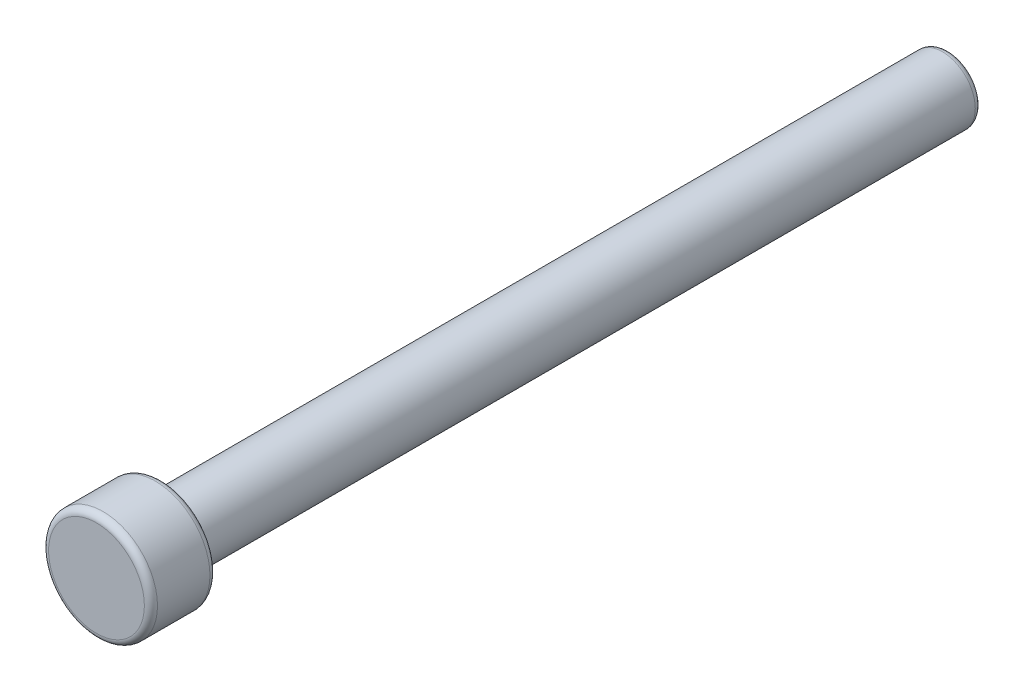
from build123d import *

# Parameters (mm, degrees)
SKETCH1_R           = 2.5
BOSS_EXTRUDE1_DEPTH = 60
SKETCH2_R           = 4.15
BOSS_EXTRUDE2_DEPTH = 5
FILLET1_R           = 0.5


with BuildPart() as part:
    # Sketch1 → Boss-Extrude1 (new body)
    with BuildSketch(Plane.XY):
        Circle(SKETCH1_R)
    extrude(amount=BOSS_EXTRUDE1_DEPTH)

    # Sketch2 → Boss-Extrude2 (add)
    with BuildSketch(Plane.XY.offset(60)):
        Circle(SKETCH2_R)
    extrude(amount=BOSS_EXTRUDE2_DEPTH)

    # Fillet1
    fillet1_edges = [part.edges().sort_by_distance(p)[0] for p in [
        (-2.5, 0, 0),
        (-2.5, 0, 60),
        (-4.15, 0, 60),
        (-4.15, 0, 65),
    ]]
    fillet(fillet1_edges, radius=FILLET1_R)


solid = part.part
